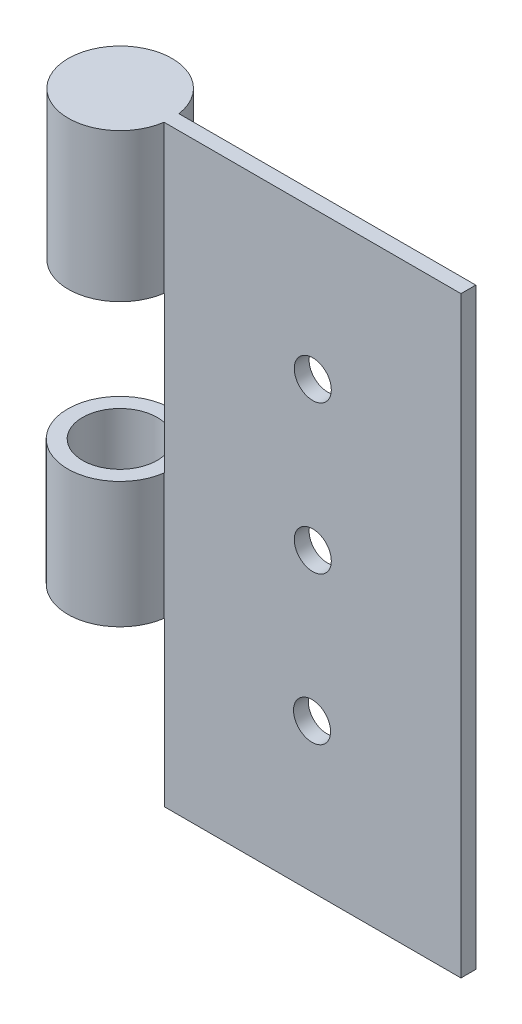
from build123d import *

# Parameters (mm, degrees)
SKETCH1_W                   = 50.8
SKETCH1_H                   = 101.6
BOSS_EXTRUDE2_DEPTH         = 2.54
F_1_4_0_25_DIAMETER_HOLE1_D = 6.35
SKETCH5_W                   = 2.54
SKETCH5_H                   = 25.4
BOSS_EXTRUDE3_REACH         = 116.046
BOSS_EXTRUDE3_END_RADIUS    = 6.35
SKETCH6_W                   = 2.54
SKETCH6_H                   = 25.4
SKETCH7_W                   = 2.54
SKETCH7_H                   = 21.59
BOSS_EXTRUDE4_REACH         = 116.05
BOSS_EXTRUDE4_END_RADIUS    = 6.395590949
SKETCH8_W                   = 2.54
SKETCH8_H                   = 21.59
BOSS_EXTRUDE5_START         = -2.54
SKETCH9_R                   = 6.35
BOSS_EXTRUDE5_DEPTH         = 2.54


with BuildPart() as part:
    # Sketch1 → Boss-Extrude2 (new body)
    with BuildSketch(Plane.XY):
        with Locations((25.4, 50.8)):
            Rectangle(SKETCH1_W, SKETCH1_H)
    extrude(amount=-BOSS_EXTRUDE2_DEPTH)

    # 1/4 (0.25) Diameter Hole1 (through all)
    with Locations(Plane(origin=(25.4, 76.2, 0), x_dir=(1, 0, 0), z_dir=(0, 0, 1))):
        with Locations((0, 0), (-0.127319097, -50.8), (0, -25.4)):
            Hole(F_1_4_0_25_DIAMETER_HOLE1_D / 2)



with BuildPart() as body_2:
    # Sketch5 → Revolve2 (revolve)
    with BuildSketch(Plane.XY.offset(-1.27), mode=Mode.PRIVATE) as revolve2_sk:
        with Locations((-1.27, 88.9)):
            Rectangle(SKETCH5_W, SKETCH5_H)
    revolve(revolve2_sk.sketch.rotate(Axis((-8.89, 0, -1.27), (0, 1, 0)), 90), axis=Axis((-8.89, 0, -1.27), (0, 1, 0)))


with BuildPart() as part_1:
    add(part.part)

    add(body_2.part)  # Boss-Extrude3 merges body 2
    # Boss-Extrude3: up to this cylinder (the profile starts outside it)
    boss_extrude3_end = Plane(origin=(-8.89, 88.9, -1.27), z_dir=(0, -1, 0)) * Cylinder(BOSS_EXTRUDE3_END_RADIUS, 245.792, mode=Mode.PRIVATE)
    # Sketch6 → Boss-Extrude3 (add, up to the surface)
    with BuildSketch(Plane.ZY, mode=Mode.PRIVATE) as boss_extrude3_sk1:
        with Locations((-1.27, 88.9)):
            Rectangle(SKETCH6_W, SKETCH6_H)
    boss_extrude3_tool1 = extrude(boss_extrude3_sk1.sketch, amount=BOSS_EXTRUDE3_REACH, mode=Mode.PRIVATE) - boss_extrude3_end
    add(boss_extrude3_tool1.solids().sort_by_distance((0, 88.9, -1.27))[0])



with BuildPart() as body_2_2:
    # Sketch7 → Revolve3 (revolve)
    with BuildSketch(Plane.XY.offset(-1.27), mode=Mode.PRIVATE) as revolve3_sk:
        with Locations((-1.27, 38.735)):
            Rectangle(SKETCH7_W, SKETCH7_H)
    revolve(revolve3_sk.sketch.rotate(Axis((-8.935590949, 101.6, -1.27), (0, -1, 0)), 180), axis=Axis((-8.935590949, 101.6, -1.27), (0, -1, 0)))


with BuildPart() as part_2:
    add(part_1.part)

    add(body_2_2.part)  # Boss-Extrude4 merges body 2 2
    # Boss-Extrude4: up to this cylinder (the profile starts outside it)
    boss_extrude4_end = Plane(origin=(-8.935590949, 38.735, -1.27), z_dir=(0, 1, 0)) * Cylinder(BOSS_EXTRUDE4_END_RADIUS, 245.891181898, mode=Mode.PRIVATE)
    # Sketch8 → Boss-Extrude4 (add, up to the surface)
    with BuildSketch(Plane.ZY, mode=Mode.PRIVATE) as boss_extrude4_sk1:
        with Locations((-1.27, 38.735)):
            Rectangle(SKETCH8_W, SKETCH8_H)
    boss_extrude4_tool1 = extrude(boss_extrude4_sk1.sketch, amount=BOSS_EXTRUDE4_REACH, mode=Mode.PRIVATE) - boss_extrude4_end
    add(boss_extrude4_tool1.solids().sort_by_distance((0, 38.735, -1.27))[0])

    # Sketch9 → Boss-Extrude5 (add)
    with BuildSketch(Plane(origin=(0, 101.6, 0), x_dir=(1, 0, 0), z_dir=(0, 1, 0)).offset(BOSS_EXTRUDE5_START)):
        with Locations(Location((-8.89, 1.27, 0), (0, 0, 90))):
            Circle(SKETCH9_R)
    extrude(amount=BOSS_EXTRUDE5_DEPTH)


solid = part_2.part
